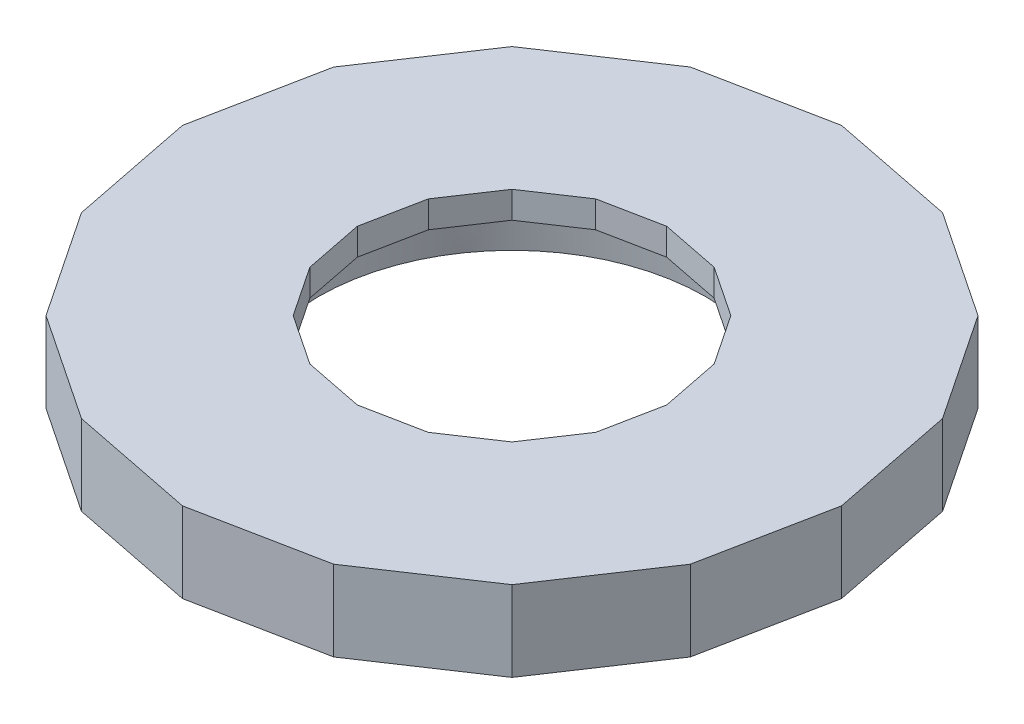
from build123d import *

# Parameters (mm, degrees)
BOSS_EXTRUDE1_DEPTH = 19.05


with BuildPart() as part:
    # Sketch1 → Boss-Extrude1 (new body)
    with BuildSketch(Plane(origin=(0, 0, 0), x_dir=(1, 0, 0), z_dir=(0, 1, 0))):
        Polygon((-78.117662847, 0), (-72.171309832, -29.894335347), (-55.23752913, -55.23752913), (-29.894335347, -72.171309832), (0, -78.117662847), (29.894335347, -72.171309832), (55.23752913, -55.23752913), (72.171309832, -29.894335347), (78.117662847, 0), (72.171309832, 29.894335347), (55.23752913, 55.23752913), (29.894335347, 72.171309832), (0, 78.117662847), (-29.894335347, 72.171309832), (-55.23752913, 55.23752913), (-72.171309832, 29.894335347), align=None)
        Polygon((-36.681478178, 0), (-33.889266911, -14.037393973), (-25.937721963, -25.937721963), (-14.037393973, -33.889266911), (0, -36.681478178), (14.037393973, -33.889266911), (25.937721963, -25.937721963), (33.889266911, -14.037393973), (36.681478178, 0), (33.889266911, 14.037393973), (25.937721963, 25.937721963), (14.037393973, 33.889266911), (0, 36.681478178), (-14.037393973, 33.889266911), (-25.937721963, 25.937721963), (-33.889266911, 14.037393973), align=None, mode=Mode.SUBTRACT)
    extrude(amount=BOSS_EXTRUDE1_DEPTH)

    # Sketch6 → Cut-Revolve1 (revolve, cut)
    with BuildSketch(Plane.XY, mode=Mode.PRIVATE) as cut_revolve1_sk:
        Polygon((-44.783182261, 12.7), (-45.894288288, 0), (-10.218904836, 0), (-10.218904836, 12.7), align=None)
    revolve(cut_revolve1_sk.sketch.rotate(Axis((0, 0, 0), (0, 1, 0)), 180), axis=Axis((0, 0, 0), (0, 1, 0)), mode=Mode.SUBTRACT)


solid = part.part
